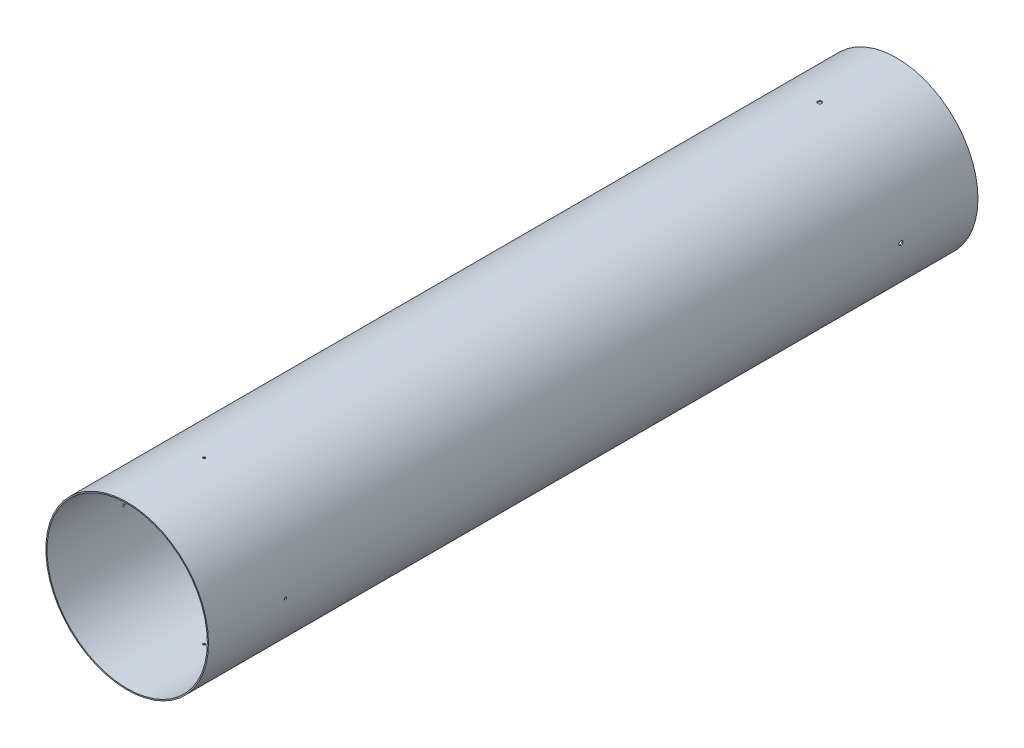
from build123d import *

# Parameters (mm, degrees)
SKETCH1_R                       = 80.518
SKETCH1_R_2                     = 79.375
BOSS_EXTRUDE1_DEPTH             = 762
TAP_DRILL_FOR_10_32_TAP1_REACH  = 784.981
TAP_DRILL_FOR_10_32_TAP1_BORE_R = 2.0193
TAP_DRILL_FOR_4_40_TAP1_REACH   = 784.981
TAP_DRILL_FOR_4_40_TAP1_BORE_R  = 1.1303
CIRPATTERN1_COUNT               = 4


with BuildPart() as part:
    # Sketch1 → Boss-Extrude1 (new body)
    with BuildSketch(Plane.XY):
        Circle(SKETCH1_R)
        Circle(SKETCH1_R_2, mode=Mode.SUBTRACT)
    extrude(amount=BOSS_EXTRUDE1_DEPTH)

    # Tap Drill for #10-32 Tap1 bore → Tap Drill for #10-32 Tap1 (cut, up to next)
    with BuildSketch(Plane(origin=(0, 80.518, 0), x_dir=(1, 0, 0), z_dir=(0, 1, 0)), mode=Mode.PRIVATE) as tap_drill_for_10_32_tap1_sk1:
        with Locations((0, -76.2)):
            Circle(TAP_DRILL_FOR_10_32_TAP1_BORE_R)
    tap_drill_for_10_32_tap1_tool1 = extrude(tap_drill_for_10_32_tap1_sk1.sketch, amount=-TAP_DRILL_FOR_10_32_TAP1_REACH, mode=Mode.PRIVATE) & part.part
    tap_drill_for_10_32_tap1 = tap_drill_for_10_32_tap1_tool1.solids().sort_by_distance((0, 80.518, 76.2))[0]
    add(tap_drill_for_10_32_tap1, mode=Mode.SUBTRACT)

    # Tap Drill for #4-40 Tap1 bore → Tap Drill for #4-40 Tap1 (cut, up to next)
    with BuildSketch(Plane(origin=(0, 80.518, 0), x_dir=(1, 0, 0), z_dir=(0, 1, 0)), mode=Mode.PRIVATE) as tap_drill_for_4_40_tap1_sk1:
        with Locations((0, -685.8)):
            Circle(TAP_DRILL_FOR_4_40_TAP1_BORE_R)
    tap_drill_for_4_40_tap1_tool1 = extrude(tap_drill_for_4_40_tap1_sk1.sketch, amount=-TAP_DRILL_FOR_4_40_TAP1_REACH, mode=Mode.PRIVATE) & part.part
    tap_drill_for_4_40_tap1 = tap_drill_for_4_40_tap1_tool1.solids().sort_by_distance((0, 80.518, 685.8))[0]
    add(tap_drill_for_4_40_tap1, mode=Mode.SUBTRACT)

    # CirPattern1: Tap Drill for #10-32 Tap1, Tap Drill for #4-40 Tap1 ×4 about axis
    cirpattern1_axis = Axis((0, 0, 762), (0, 0, 1))
    add([tap_drill_for_10_32_tap1.rotate(cirpattern1_axis, i * 360 / CIRPATTERN1_COUNT) for i in range(1, CIRPATTERN1_COUNT)], mode=Mode.SUBTRACT)
    add([tap_drill_for_4_40_tap1.rotate(cirpattern1_axis, i * 360 / CIRPATTERN1_COUNT) for i in range(1, CIRPATTERN1_COUNT)], mode=Mode.SUBTRACT)


solid = part.part
